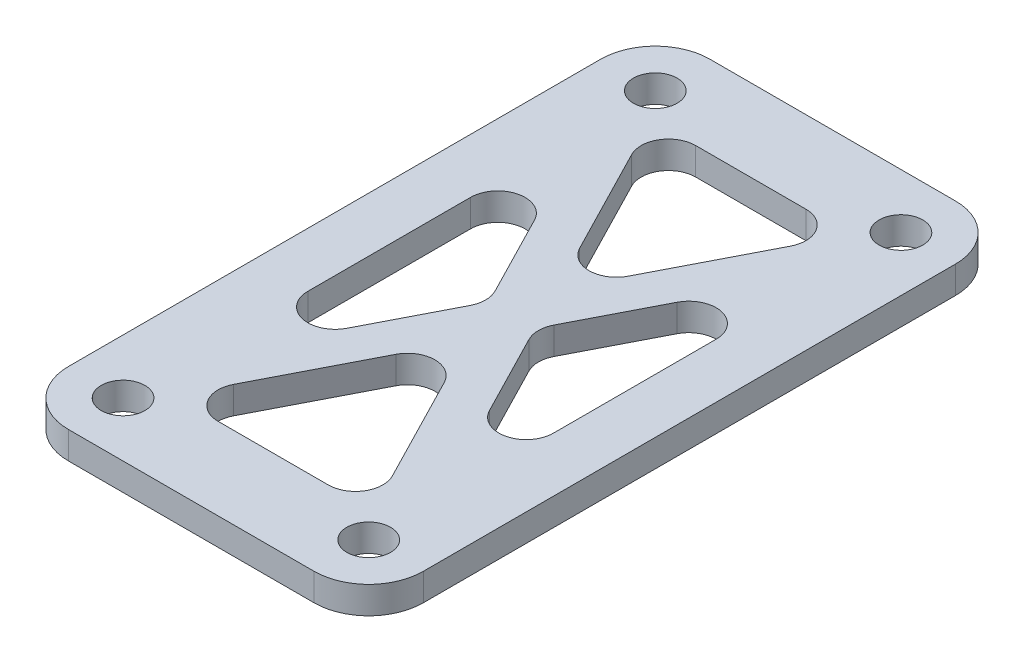
from build123d import *

# Parameters (mm, degrees)
SKETCH1_W           = 26
SKETCH1_H           = 47
SKETCH1_R           = 1.6
BOSS_EXTRUDE1_DEPTH = 2
FILLET1_R           = 4
SKETCH2_W           = 18
SKETCH2_H           = 35
CUT_EXTRUDE1_DEPTH  = 2
EXTRUDE_THIN1_DEPTH = 2
FILLET2_R           = 2


with BuildPart() as part:
    # Sketch1 → Boss-Extrude1 (new body)
    with BuildSketch(Plane(origin=(0, 0, 0), x_dir=(1, 0, 0), z_dir=(0, 1, 0))):
        with Locations((9, -19.5)):
            Rectangle(SKETCH1_W, SKETCH1_H)
        with Locations(Location((0, -39, 0), (0, 0, 270))):
            Circle(SKETCH1_R, mode=Mode.SUBTRACT)
        with Locations(Location((18, 0, 0), (0, 0, 270))):
            Circle(SKETCH1_R, mode=Mode.SUBTRACT)
        with Locations(Location((0, 0, 0), (0, 0, 270))):
            Circle(SKETCH1_R, mode=Mode.SUBTRACT)
        with Locations(Location((18, -39, 0), (0, 0, 270))):
            Circle(SKETCH1_R, mode=Mode.SUBTRACT)
    extrude(amount=BOSS_EXTRUDE1_DEPTH)

    # Fillet1
    fillet1_edges = [part.edges().sort_by_distance(p)[0] for p in [
        (-4, 1, -4),
        (22, 1, -4),
        (22, 1, 43),
        (-4, 1, 43),
    ]]
    fillet(fillet1_edges, radius=FILLET1_R)

    # Sketch2 → Cut-Extrude1 (cut)
    with BuildSketch(Plane(origin=(0, 2, 0), x_dir=(1, 0, 0), z_dir=(0, 1, 0))):
        with Locations((9, -19.5)):
            Rectangle(SKETCH2_W, SKETCH2_H)
    extrude(amount=-CUT_EXTRUDE1_DEPTH, mode=Mode.SUBTRACT)

    # Sketch3 → Extrude-Thin1 (add)
    with BuildSketch(Plane(origin=(0, 2, 0), x_dir=(1, 0, 0), z_dir=(0, 1, 0))):
        Polygon((-1.333931703, -2.686022019), (16.666068297, -37.686022019), (19.333931703, -36.313977981), (1.333931703, -1.313977981), align=None)
        Polygon((16.666068297, -1.313977981), (-1.333931703, -36.313977981), (1.333931703, -37.686022019), (19.333931703, -2.686022019), align=None)
    extrude(amount=-EXTRUDE_THIN1_DEPTH)

    # Fillet2
    fillet2_edges = [part.edges().sort_by_distance(p)[0] for p in [
        (1.686743027, 1, 37),
        (16.313256973, 1, 37),
        (18, 1, 5.279778109),
        (18, 1, 33.720221891),
        (16.313256973, 1, 2),
        (1.686743027, 1, 2),
        (0, 1, 33.720221891),
        (0, 1, 5.279778109),
        (7.313256973, 1, 19.5),
        (9, 1, 16.220221891),
        (10.686743027, 1, 19.5),
        (9, 1, 22.779778109),
    ]]
    fillet(fillet2_edges, radius=FILLET2_R)


solid = part.part
